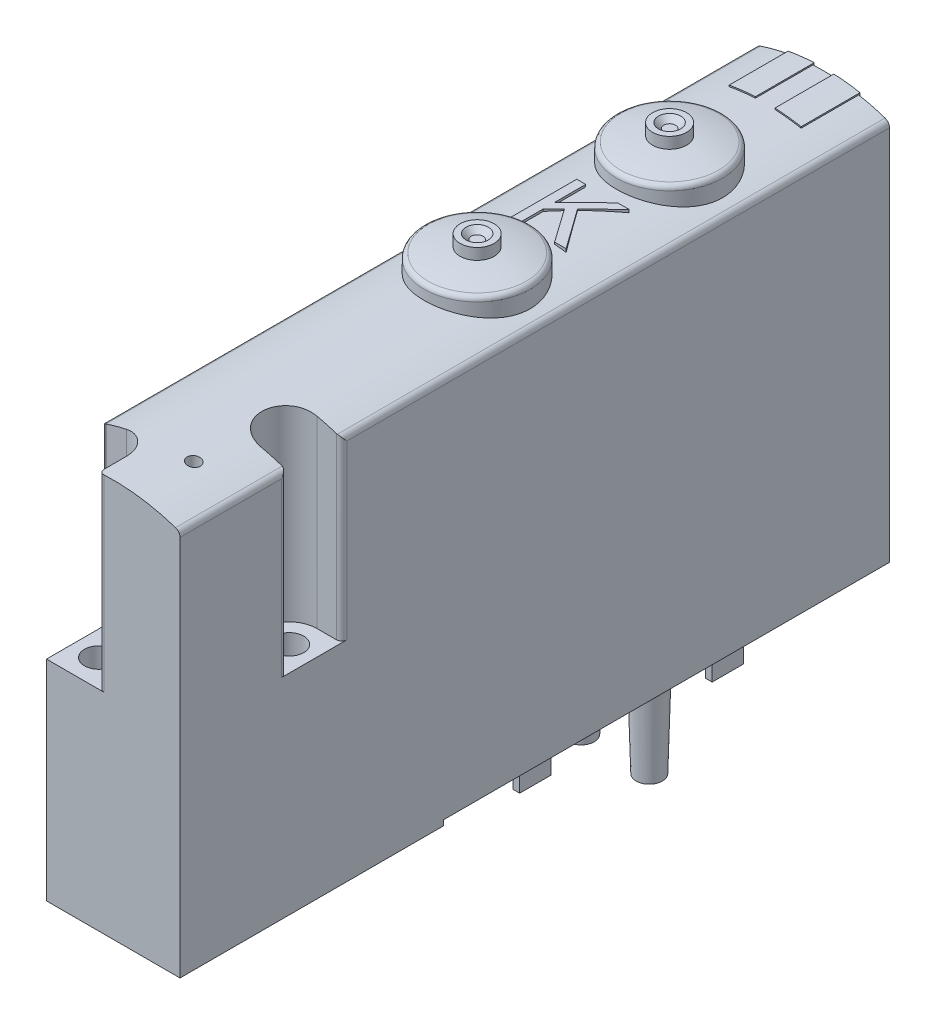
from build123d import *

# Parameters (mm, degrees)
BOSS_EXTRUDE1_DEPTH     = 54.2
BOSS_EXTRUDE2_DEPTH     = 1.1
SKETCH3_R               = 1.1
CUT_EXTRUDE1_DEPTH      = 31
CUT_EXTRUDE2_DEPTH      = 14.4
SKETCH5_R               = 1.1
CUT_EXTRUDE3_DEPTH      = 31
CUT_EXTRUDE4_DEPTH      = 14.4
CUT_EXTRUDE5_DEPTH      = 6
CUT_EXTRUDE5_DEPTH_BACK = 6
SKETCH7_W               = 34.1
SKETCH7_H               = 0.4
CUT_EXTRUDE6_DEPTH      = 1.9
CUT_EXTRUDE7_DEPTH      = 1.9
SKETCH14_W              = 0.5
SKETCH14_H              = 2.4
BOSS_EXTRUDE3_DEPTH     = 2.5
SKETCH15_W              = 0.5
SKETCH15_H              = 2.4
BOSS_EXTRUDE4_DEPTH     = 2.5
SKETCH16_W              = 0.5
SKETCH16_H              = 2.4
BOSS_EXTRUDE5_DEPTH     = 2.5
SKETCH17_W              = 0.5
SKETCH17_H              = 2.4
BOSS_EXTRUDE6_DEPTH     = 2.5
BOSS_EXTRUDE7_DEPTH     = 4.5
BOSS_EXTRUDE8_DEPTH     = 4.5


with BuildPart() as part:
    # Sketch1 → Boss-Extrude1 (new body)
    with BuildSketch(Plane.XY.offset(-23.2)):
        with BuildLine():
            Line((-5.1, 29.150999964), (-5.1, 0))
            Line((-5.1, 0), (5.1, 0))
            Line((5.1, 0), (5.1, 29.150999964))
            ThreePointArc((5.1, 29.150999964), (5.005777258, 29.443138316), (4.758620732, 29.625172362))
            ThreePointArc((4.758620732, 29.625172362), (2.2e-08, 30.4), (-4.75862069, 29.625172376))
            ThreePointArc((-4.75862069, 29.625172376), (-5.005777245, 29.443138334), (-5.1, 29.150999964))
        make_face()
    extrude(amount=BOSS_EXTRUDE1_DEPTH)

    # Sketch2 → Boss-Extrude2 (add)
    with BuildSketch(Plane(origin=(0, 29.4, 0), x_dir=(1, 0, 0), z_dir=(0, 1, 0))):
        Polygon((-2.09375, 1.5), (-1.40625, 1.5), (-1.40625, 3.25), (-0.59375, 4.0625), (1.21875, 1.5), (2.09375, 1.5), (-0.09375, 4.5625), (1.90625, 6.5), (1.03125, 6.5), (-1.40625, 4.125), (-1.40625, 6.5), (-2.09375, 6.5), align=None)
    extrude(amount=BOSS_EXTRUDE2_DEPTH)

    # Sketch3 → Cut-Extrude1 (cut)
    with BuildSketch(Plane(origin=(0, 30.4, 0), x_dir=(1, 0, 0), z_dir=(0, 1, 0))):
        with Locations(Location((3.2, -20.75, 0), (0, 0, 270))):
            Circle(SKETCH3_R)
    extrude(amount=-CUT_EXTRUDE1_DEPTH, mode=Mode.SUBTRACT)

    # Sketch4 → Cut-Extrude2 (cut)
    with BuildSketch(Plane(origin=(0, 30.4, 0), x_dir=(1, 0, 0), z_dir=(0, 1, 0))):
        with BuildLine():
            Line((3.2, -22.85), (4.7, -22.85))
            ThreePointArc((4.7, -22.85), (4.982842712, -22.967157288), (5.1, -23.25))
            Line((5.1, -23.25), (6.2, -23.25))
            Line((6.2, -23.25), (6.2, -18.25))
            Line((6.2, -18.25), (5.1, -18.25))
            ThreePointArc((5.1, -18.25), (4.982842712, -18.532842712), (4.7, -18.65))
            Line((4.7, -18.65), (3.2, -18.65))
            ThreePointArc((3.2, -18.65), (1.1, -20.75), (3.2, -22.85))
        make_face()
    extrude(amount=-CUT_EXTRUDE2_DEPTH, mode=Mode.SUBTRACT)

    # Sketch5 → Cut-Extrude3 (cut)
    with BuildSketch(Plane(origin=(0, 30.4, 0), x_dir=(1, 0, 0), z_dir=(0, 1, 0))):
        with Locations(Location((-3.2, -28.9, 0), (0, 0, 270))):
            Circle(SKETCH5_R)
    extrude(amount=-CUT_EXTRUDE3_DEPTH, mode=Mode.SUBTRACT)

    # Sketch6 → Cut-Extrude4 (cut)
    with BuildSketch(Plane(origin=(0, 30.4, 0), x_dir=(1, 0, 0), z_dir=(0, 1, 0))):
        with BuildLine():
            Line((-6.2, -26.4), (-6.2, -31.9))
            Line((-6.2, -31.9), (-0.7, -31.9))
            Line((-0.7, -31.9), (-0.7, -31))
            ThreePointArc((-0.7, -31), (-0.982842712, -30.882842712), (-1.1, -30.6))
            Line((-1.1, -30.6), (-1.1, -28.9))
            ThreePointArc((-1.1, -28.9), (-1.71507576, -27.41507576), (-3.2, -26.8))
            Line((-3.2, -26.8), (-4.7, -26.8))
            ThreePointArc((-4.7, -26.8), (-4.982842712, -26.682842712), (-5.1, -26.4))
            Line((-5.1, -26.4), (-6.2, -26.4))
        make_face()
    extrude(amount=-CUT_EXTRUDE4_DEPTH, mode=Mode.SUBTRACT)

    # Sketch7 → Cut-Extrude5 (cut, two sides: drawn at the far end of the back side and taken through both)
    with BuildSketch(Plane(origin=(0, 0, 0), x_dir=(0, 0, -1), z_dir=(1, 0, 0)).offset(-CUT_EXTRUDE5_DEPTH_BACK)):
        with Locations((6.17, 0.2)):
            Rectangle(SKETCH7_W, SKETCH7_H)
    extrude(amount=CUT_EXTRUDE5_DEPTH + CUT_EXTRUDE5_DEPTH_BACK, mode=Mode.SUBTRACT)

    # Sketch8 → Cut-Extrude6 (cut)
    with BuildSketch(Plane(origin=(0, 0, 0), x_dir=(1, 0, 0), z_dir=(0, 1, 0))):
        with BuildLine():
            Line((-3.15, 2.465258607), (-3.15, -2.465258607))
            ThreePointArc((-3.15, -2.465258607), (0, -4), (3.15, -2.465258607))
            Line((3.15, -2.465258607), (3.15, 2.465258607))
            ThreePointArc((3.15, 2.465258607), (0, 4), (-3.15, 2.465258607))
        make_face()
    extrude(amount=CUT_EXTRUDE6_DEPTH, mode=Mode.SUBTRACT)

    # Sketch9 → Cut-Extrude7 (cut)
    with BuildSketch(Plane(origin=(0, 0, 0), x_dir=(1, 0, 0), z_dir=(0, 1, 0))):
        with BuildLine():
            Line((-3.15, 17.165258607), (-3.15, 12.234741393))
            ThreePointArc((-3.15, 12.234741393), (0, 10.7), (3.15, 12.234741393))
            Line((3.15, 12.234741393), (3.15, 17.165258607))
            ThreePointArc((3.15, 17.165258607), (0, 18.7), (-3.15, 17.165258607))
        make_face()
    extrude(amount=CUT_EXTRUDE7_DEPTH, mode=Mode.SUBTRACT)

    # Sketch10 → Revolve1 (revolve)
    with BuildSketch(Plane(origin=(0, 0, 0), x_dir=(0, 0, -1), z_dir=(1, 0, 0)), mode=Mode.PRIVATE) as revolve1_sk:
        Polygon((0, 2.1), (3.05, 2.1), (3.05, 1.1), (2.25, 1.1), (2.25, -1.4), (2.65, -1.4), (2.65, -1.72), (2.430606898, -2.1), (0, -2.1), align=None)
    revolve(revolve1_sk.sketch.rotate(Axis((0, -2.1, 0), (0, 1, 0)), 180), axis=Axis((0, -2.1, 0), (0, 1, 0)))

    # Sketch11 → Revolve2 (revolve)
    with BuildSketch(Plane(origin=(0, 0, 0), x_dir=(0, 0, -1), z_dir=(1, 0, 0)), mode=Mode.PRIVATE) as revolve2_sk:
        Polygon((14.7, 2.1), (17.75, 2.1), (17.75, 1.1), (16.95, 1.1), (16.95, -1.4), (17.35, -1.4), (17.35, -1.72), (17.130606898, -2.1), (14.7, -2.1), align=None)
    revolve(revolve2_sk.sketch.rotate(Axis((0, -2.1, -14.7), (0, 1, 0)), 180), axis=Axis((0, -2.1, -14.7), (0, 1, 0)))

    # Sketch12 → Revolve3 (revolve)
    with BuildSketch(Plane.XY.offset(-7.35), mode=Mode.PRIVATE) as revolve3_sk:
        with BuildLine():
            Line((2.6, 0.4), (3.8, 0.4))
            Line((3.8, 0.4), (3.6, -6.9))
            ThreePointArc((3.6, -6.9), (3.106540729, -7.021444616), (2.6, -7.06227766))
            Line((2.6, -7.06227766), (2.6, 0.4))
        make_face()
    revolve(revolve3_sk.sketch.rotate(Axis((2.6, -7.06227766, -7.35), (0, 1, 0)), 270), axis=Axis((2.6, -7.06227766, -7.35), (0, 1, 0)))

    # Sketch13 → Revolve4 (revolve)
    with BuildSketch(Plane.XY.offset(-7.35), mode=Mode.PRIVATE) as revolve4_sk:
        with BuildLine():
            Line((-2.6, 0.4), (-1.4, 0.4))
            Line((-1.4, 0.4), (-1.6, -6.9))
            ThreePointArc((-1.6, -6.9), (-2.093459271, -7.021444616), (-2.6, -7.06227766))
            Line((-2.6, -7.06227766), (-2.6, 0.4))
        make_face()
    revolve(revolve4_sk.sketch.rotate(Axis((-2.6, -7.06227766, -7.35), (0, 1, 0)), 270), axis=Axis((-2.6, -7.06227766, -7.35), (0, 1, 0)))

    # Sketch14 → Boss-Extrude3 (add)
    with BuildSketch(Plane(origin=(0, -2.1, 0), x_dir=(-1, 0, 0), z_dir=(0, -1, 0))):
        with Locations((-1, 0)):
            Rectangle(SKETCH14_W, SKETCH14_H)
    extrude(amount=BOSS_EXTRUDE3_DEPTH)

    # Sketch15 → Boss-Extrude4 (add)
    with BuildSketch(Plane(origin=(0, -2.1, 0), x_dir=(-1, 0, 0), z_dir=(0, -1, 0))):
        with Locations((1, 0)):
            Rectangle(SKETCH15_W, SKETCH15_H)
    extrude(amount=BOSS_EXTRUDE4_DEPTH)

    # Sketch16 → Boss-Extrude5 (add)
    with BuildSketch(Plane(origin=(0, -2.1, 0), x_dir=(-1, 0, 0), z_dir=(0, -1, 0))):
        with Locations((-1, 14.7)):
            Rectangle(SKETCH16_W, SKETCH16_H)
    extrude(amount=BOSS_EXTRUDE5_DEPTH)

    # Sketch17 → Boss-Extrude6 (add)
    with BuildSketch(Plane(origin=(0, -2.1, 0), x_dir=(-1, 0, 0), z_dir=(0, -1, 0))):
        with Locations((1, 14.7)):
            Rectangle(SKETCH17_W, SKETCH17_H)
    extrude(amount=BOSS_EXTRUDE6_DEPTH)

    # Sketch18 → Revolve5 (revolve)
    with BuildSketch(Plane(origin=(0, 0, 0), x_dir=(0, 0, -1), z_dir=(1, 0, 0)), mode=Mode.PRIVATE) as revolve5_sk:
        with BuildLine():
            Line((-3.2, 32.4), (-2.75, 32.4))
            Line((-2.75, 32.4), (-2.35, 32.8))
            Line((-2.35, 32.8), (-1.9, 32.8))
            Line((-1.9, 32.8), (-1.9, 31.943560486))
            ThreePointArc((-1.9, 31.943560486), (-0.666287758, 31.784461515), (0.549999769, 31.523687608))
            ThreePointArc((0.549999769, 31.523687608), (0.766227693, 31.381338282), (0.85, 31.136389214))
            Line((0.85, 31.136389214), (0.85, 28.1))
            Line((0.85, 28.1), (-3.2, 28.1))
            Line((-3.2, 28.1), (-3.2, 32.4))
        make_face()
    revolve(revolve5_sk.sketch.rotate(Axis((0, 28.1, 3.2), (0, 1, 0)), 180), axis=Axis((0, 28.1, 3.2), (0, 1, 0)))

    # Sketch19 → Revolve6 (revolve)
    with BuildSketch(Plane(origin=(0, 0, 0), x_dir=(0, 0, -1), z_dir=(1, 0, 0)), mode=Mode.PRIVATE) as revolve6_sk:
        with BuildLine():
            Line((11.5, 32.4), (11.95, 32.4))
            Line((11.95, 32.4), (12.35, 32.8))
            Line((12.35, 32.8), (12.8, 32.8))
            Line((12.8, 32.8), (12.8, 31.943560486))
            ThreePointArc((12.8, 31.943560486), (14.033712242, 31.784461515), (15.249999769, 31.523687608))
            ThreePointArc((15.249999769, 31.523687608), (15.466227693, 31.381338282), (15.55, 31.136389214))
            Line((15.55, 31.136389214), (15.55, 28.1))
            Line((15.55, 28.1), (11.5, 28.1))
            Line((11.5, 28.1), (11.5, 32.4))
        make_face()
    revolve(revolve6_sk.sketch.rotate(Axis((0, 28.1, -11.5), (0, 1, 0)), 180), axis=Axis((0, 28.1, -11.5), (0, 1, 0)))

    # Sketch20 → Cut-Revolve1 (revolve, cut)
    with BuildSketch(Plane.XY.offset(26.6), mode=Mode.PRIVATE) as cut_revolve1_sk:
        Polygon((1.75, 30.5), (2.25, 30.5), (2.25, 25.3), (1.75, 25.011324865), align=None)
    revolve(cut_revolve1_sk.sketch.rotate(Axis((1.75, 25.011324865, 26.6), (0, 1, 0)), 270), axis=Axis((1.75, 25.011324865, 26.6), (0, 1, 0)), mode=Mode.SUBTRACT)

    # Sketch21 → Boss-Extrude7 (add)
    with BuildSketch(Plane.XY.offset(-23.3)):
        with BuildLine():
            Line((0.75, 30.481362671), (0.75, 27))
            Line((0.75, 27), (2.75, 27))
            Line((2.75, 27), (2.75, 30.247474533))
            ThreePointArc((2.75, 30.247474533), (1.753903052, 30.397793974), (0.75, 30.481362671))
        make_face()
    extrude(amount=BOSS_EXTRUDE7_DEPTH)

    # Sketch22 → Boss-Extrude8 (add)
    with BuildSketch(Plane.XY.offset(-23.3)):
        with BuildLine():
            Line((-2.75, 30.247474533), (-2.75, 27))
            Line((-2.75, 27), (-0.75, 27))
            Line((-0.75, 27), (-0.75, 30.481362671))
            ThreePointArc((-0.75, 30.481362671), (-1.753903052, 30.397793974), (-2.75, 30.247474533))
        make_face()
    extrude(amount=BOSS_EXTRUDE8_DEPTH)


solid = part.part
